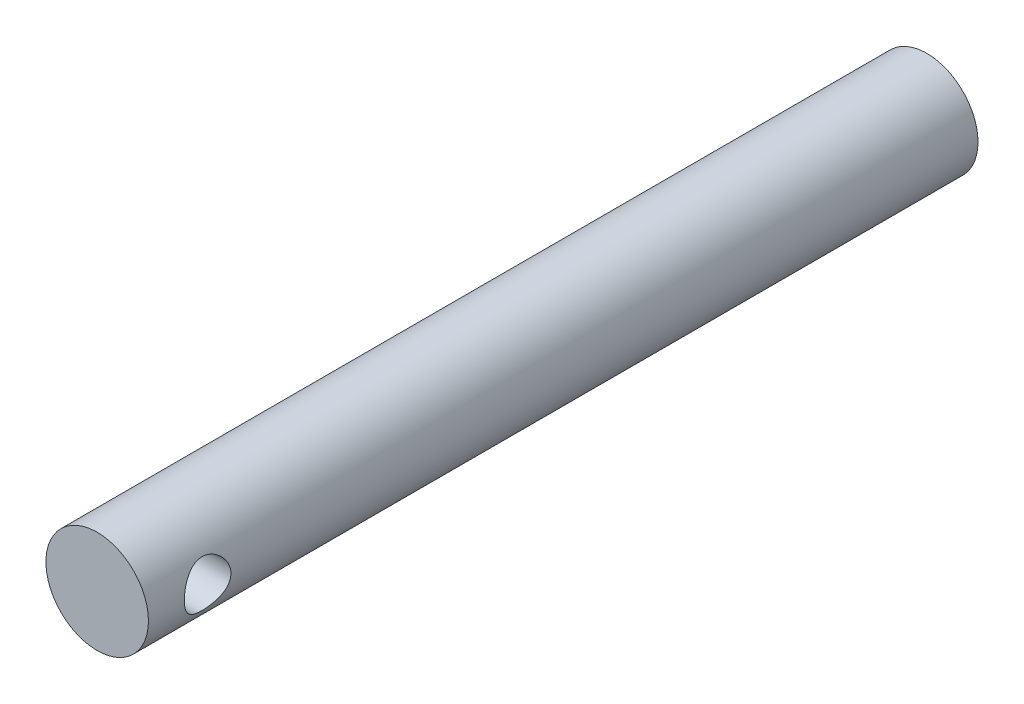
from build123d import *

# Parameters (mm, degrees)
SKETCH1_W             = 5.5
SKETCH1_H             = 89
SKETCH2_R             = 2.5
CUT_EXTRUDE1_DEPTH    = 15
M6_TAPPED_HOLE1_D     = 4.891
M6_TAPPED_HOLE1_DEPTH = 30
M6_TAPPED_HOLE1_TIP   = 1.469404644


with BuildPart() as part:
    # Sketch1 → Revolve1 (revolve)
    with BuildSketch(Plane(origin=(0, 0, 0), x_dir=(1, 0, 0), z_dir=(0, 1, 0))):
        with Locations((2.75, 44.5)):
            Rectangle(SKETCH1_W, SKETCH1_H)
    revolve(axis=Axis((0, 0, 0), (0, 0, -1)))

    # Sketch2 → Cut-Extrude1 (cut, symmetric)
    with BuildSketch(Plane(origin=(0, 0, 0), x_dir=(0, 0, -1), z_dir=(1, 0, 0))):
        with Locations((6.35, 0)):
            Circle(SKETCH2_R)
    extrude(amount=CUT_EXTRUDE1_DEPTH, both=True, mode=Mode.SUBTRACT)

    # M6 Tapped Hole1
    with Locations(Plane(origin=(0, 0, -89), x_dir=(-1, 0, 0), z_dir=(0, 0, -1))):
        with Locations((0, 0)):
            Hole(M6_TAPPED_HOLE1_D / 2, depth=M6_TAPPED_HOLE1_DEPTH)
            with Locations((0, 0, -(M6_TAPPED_HOLE1_DEPTH + M6_TAPPED_HOLE1_TIP / 2))):  # 118° drill point
                Cone(0, M6_TAPPED_HOLE1_D / 2, M6_TAPPED_HOLE1_TIP, mode=Mode.SUBTRACT)


solid = part.part
